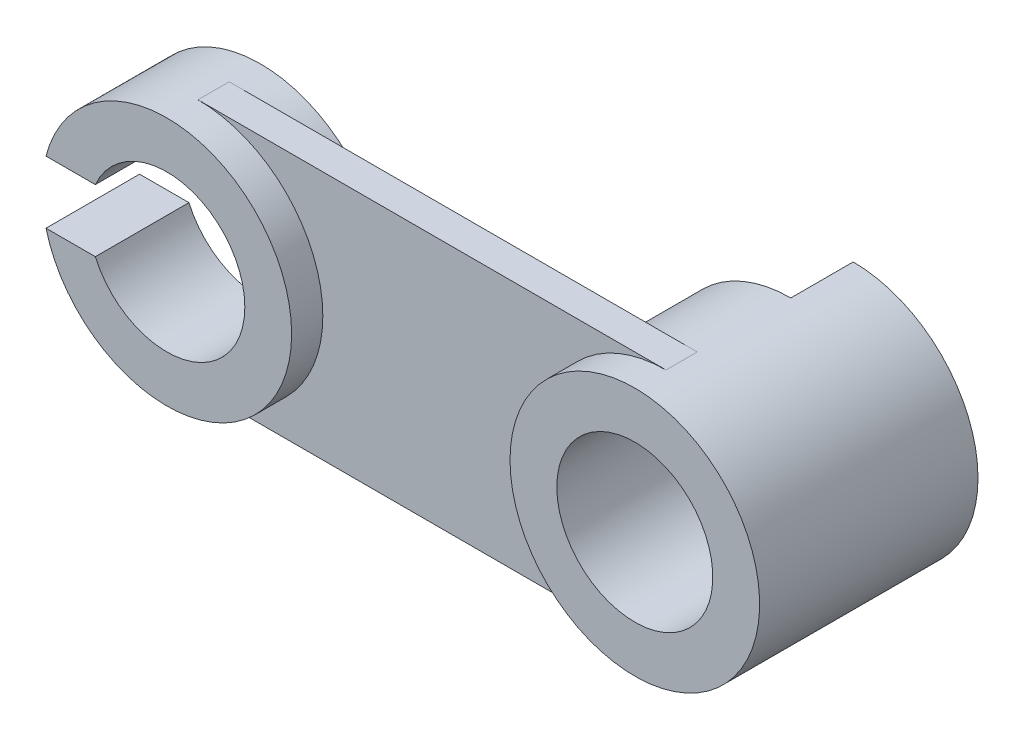
from build123d import *

# Parameters (mm, degrees)
SKETCH1_W                = 75
SKETCH1_H                = 40
BOSS_EXTRUDE1_DEPTH      = 5
BOSS_EXTRUDE2_DEPTH      = 5
BOSS_EXTRUDE2_DEPTH_BACK = 10
SKETCH4_R                = 20
CUT_EXTRUDE4_DEPTH       = 15
BOSS_EXTRUDE3_DEPTH      = 15
BOSS_EXTRUDE3_DEPTH_BACK = 10
SKETCH8_R                = 20
SKETCH9_R                = 12.5
CUT_EXTRUDE5_DEPTH       = 25
BOSS_EXTRUDE4_START      = 10
BOSS_EXTRUDE4_DEPTH      = 10
BOSS_EXTRUDE5_DEPTH      = 2.5


with BuildPart() as part:
    # Sketch1 → Boss-Extrude1 (new body)
    with BuildSketch(Plane.XY):
        Rectangle(SKETCH1_W, SKETCH1_H)
    extrude(amount=BOSS_EXTRUDE1_DEPTH)

    # Sketch4 → Boss-Extrude2 (add, two sides: drawn at the far end of the back side and taken through both)
    with BuildSketch(Plane.XY.offset(5).offset(-BOSS_EXTRUDE2_DEPTH_BACK)):
        with Locations((-37.5, 0)):
            Circle(SKETCH4_R)
    extrude(amount=BOSS_EXTRUDE2_DEPTH + BOSS_EXTRUDE2_DEPTH_BACK)

    # Sketch6 → Cut-Extrude4 (cut)
    with BuildSketch(Plane.XY.offset(10)):
        with BuildLine():
            Line((-57.5, -5), (-57.5, 5))
            Line((-57.5, 5), (-48.956439237, 5))
            ThreePointArc((-48.956439237, 5), (-25, 0), (-48.956439237, -5))
            Line((-48.956439237, -5), (-57.5, -5))
        make_face()
    extrude(amount=-CUT_EXTRUDE4_DEPTH, mode=Mode.SUBTRACT)

    # Sketch8 → Boss-Extrude3 (add, two sides: drawn at the far end of the back side and taken through both)
    with BuildSketch(Plane(origin=(0, 0, 0), x_dir=(-1, 0, 0), z_dir=(0, 0, -1)).offset(-BOSS_EXTRUDE3_DEPTH_BACK)):
        with Locations((-37.5, 0)):
            Circle(SKETCH8_R)
    extrude(amount=BOSS_EXTRUDE3_DEPTH + BOSS_EXTRUDE3_DEPTH_BACK)

    # Sketch9 → Cut-Extrude5 (cut)
    with BuildSketch(Plane(origin=(0, 0, -15), x_dir=(-1, 0, 0), z_dir=(0, 0, -1))):
        with Locations((-37.5, 0)):
            Circle(SKETCH9_R)
    extrude(amount=-CUT_EXTRUDE5_DEPTH, mode=Mode.SUBTRACT)

    # Sketch10 → Boss-Extrude4 (add)
    with BuildSketch(Plane(origin=(0, 0, -15), x_dir=(-1, 0, 0), z_dir=(0, 0, -1)).offset(BOSS_EXTRUDE4_START)):
        with BuildLine():
            Line((-37.5, -20), (-37.5, -12.5))
            ThreePointArc((-37.5, -12.5), (-50, 0), (-37.5, 12.5))
            Line((-37.5, 12.5), (-37.5, 20))
            ThreePointArc((-37.5, 20), (-57.5, 0), (-37.5, -20))
        make_face()
    extrude(amount=-BOSS_EXTRUDE4_DEPTH)


with BuildPart() as body_2:
    # Sketch11 → Boss-Extrude5 (new, symmetric)
    with BuildSketch(Plane(origin=(0, 0, 0), x_dir=(1, 0, 0), z_dir=(0, 1, 0))):
        Polygon((17.5, 15), (-2.5, 0), (17.5, 0), align=None)
    extrude(amount=BOSS_EXTRUDE5_DEPTH, both=True)


solid = Compound([part.part, body_2.part])
